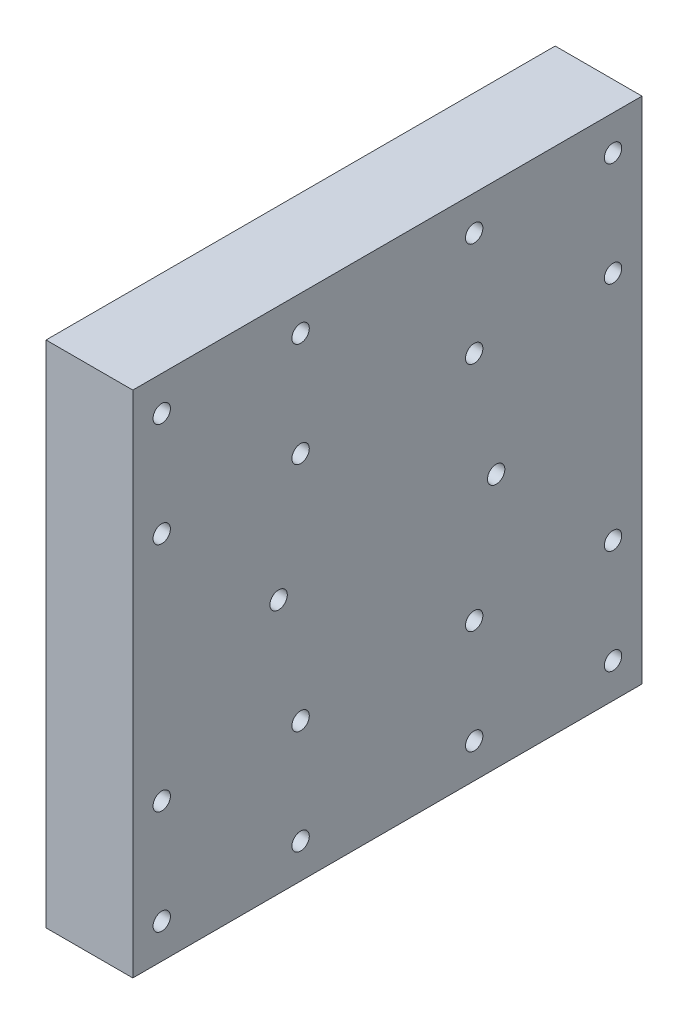
from build123d import *

# Parameters (mm, degrees)
CROQUIS1_W              = 88
CROQUIS1_H              = 88
CROQUIS1_R              = 1.5
SALIENTE_EXTRUIR1_DEPTH = 15


with BuildPart() as part:
    # Croquis1 → Saliente-Extruir1 (new body)
    with BuildSketch(Plane(origin=(0, 0, 0), x_dir=(0, 0, -1), z_dir=(1, 0, 0))):
        with Locations((44, 44)):
            Rectangle(CROQUIS1_W, CROQUIS1_H)
        with Locations((5, 82)):
            Circle(CROQUIS1_R, mode=Mode.SUBTRACT)
        with Locations((29, 82)):
            Circle(CROQUIS1_R, mode=Mode.SUBTRACT)
        with Locations((29, 64)):
            Circle(CROQUIS1_R, mode=Mode.SUBTRACT)
        with Locations((5, 64)):
            Circle(CROQUIS1_R, mode=Mode.SUBTRACT)
        with Locations(Location((59, 64, 0), (0, 0, 180))):
            Circle(CROQUIS1_R, mode=Mode.SUBTRACT)
        with Locations(Location((59, 82, 0), (0, 0, 180))):
            Circle(CROQUIS1_R, mode=Mode.SUBTRACT)
        with Locations(Location((83, 64, 0), (0, 0, 180))):
            Circle(CROQUIS1_R, mode=Mode.SUBTRACT)
        with Locations(Location((83, 82, 0), (0, 0, 180))):
            Circle(CROQUIS1_R, mode=Mode.SUBTRACT)
        with Locations((83, 24)):
            Circle(CROQUIS1_R, mode=Mode.SUBTRACT)
        with Locations((59, 24)):
            Circle(CROQUIS1_R, mode=Mode.SUBTRACT)
        with Locations((83, 6)):
            Circle(CROQUIS1_R, mode=Mode.SUBTRACT)
        with Locations((59, 6)):
            Circle(CROQUIS1_R, mode=Mode.SUBTRACT)
        with Locations(Location((29, 24, 0), (0, 0, 180))):
            Circle(CROQUIS1_R, mode=Mode.SUBTRACT)
        with Locations(Location((5, 24, 0), (0, 0, 180))):
            Circle(CROQUIS1_R, mode=Mode.SUBTRACT)
        with Locations(Location((29, 6, 0), (0, 0, 180))):
            Circle(CROQUIS1_R, mode=Mode.SUBTRACT)
        with Locations(Location((5, 6, 0), (0, 0, 180))):
            Circle(CROQUIS1_R, mode=Mode.SUBTRACT)
        with Locations((25.2, 44)):
            Circle(CROQUIS1_R, mode=Mode.SUBTRACT)
        with Locations((62.8, 44)):
            Circle(CROQUIS1_R, mode=Mode.SUBTRACT)
    extrude(amount=SALIENTE_EXTRUIR1_DEPTH)


solid = part.part
